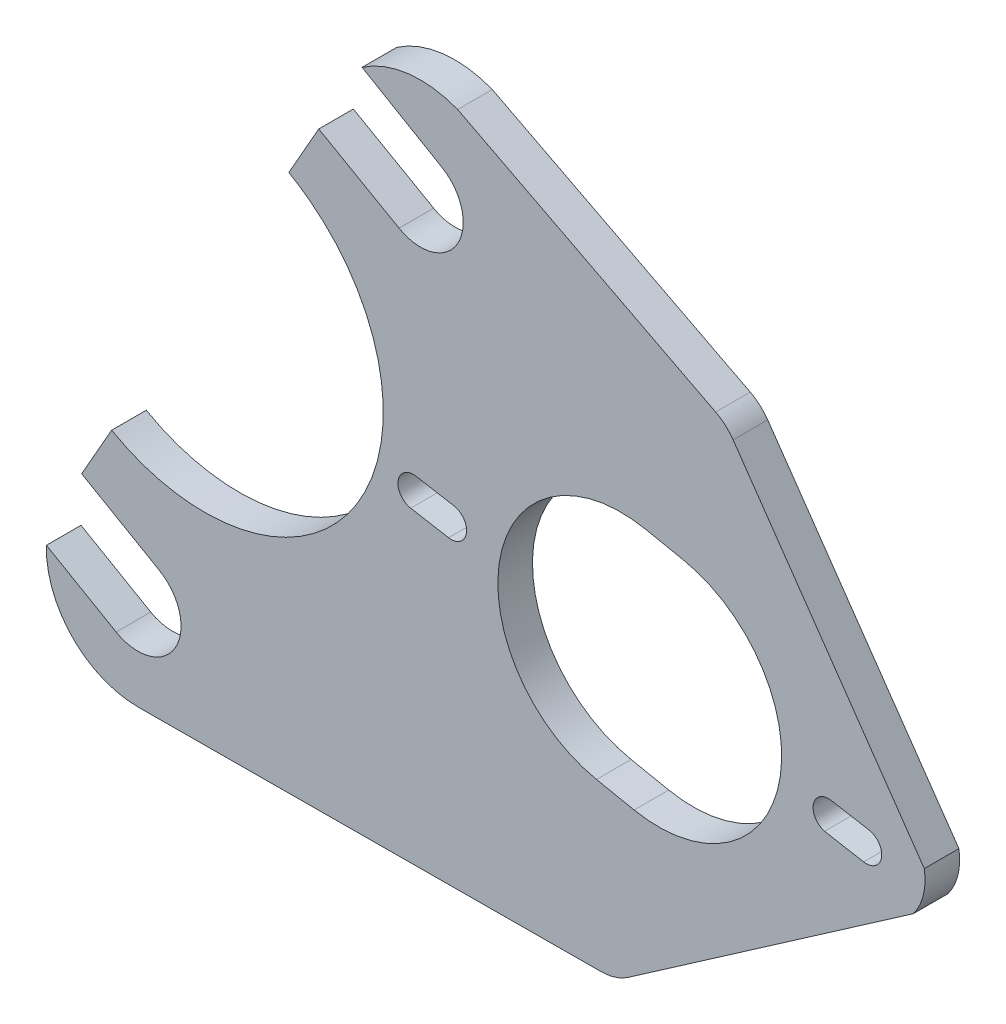
from build123d import *

# Parameters (mm, degrees)
BOSS_EXTRUDE1_DEPTH = 3.6
CUT_EXTRUDE1_DEPTH  = 10
BOSS_EXTRUDE2_DEPTH = 3.6
FILLET2_R           = 5
FILLET3_R           = 5
CUT_EXTRUDE4_DEPTH  = 10


with BuildPart() as part:
    # Model → Boss-Extrude1 (new body)
    with BuildSketch(Plane.XY):
        with BuildLine():
            ThreePointArc((50.228535872, 45.395569416), (52.924019536, 38.465315249), (59.782889449, 35.593041144))
            Line((59.782889449, 35.593041144), (113.827054853, 35.866410266))
            Line((113.827054853, 35.866410266), (139.096203594, 35.866410266))
            Line((139.096203594, 35.866410266), (143.174409672, 59.637869067))
            Line((143.174409672, 59.637869067), (92.999499813, 106.036140475))
            ThreePointArc((92.999499813, 106.036140475), (87.882885081, 106.693381362), (83.060832366, 104.860482154))
            Line((83.060832366, 104.860482154), (91.356130692, 100.009349623))
            ThreePointArc((91.356130692, 100.009349623), (92.985626216, 93.927680535), (86.903957127, 92.29818501))
            Line((86.903957127, 92.29818501), (78.555180285, 97.056247849))
            Line((78.555180285, 97.056247849), (75.4400478, 91.575203017))
            add(Edge.make_bspline(
                [(57.012133278, 59.151469471), (73.67768742, 49.679660596), (82.891644681, 65.891527369), (92.105601941, 82.103394142), (75.4400478, 91.575203017)],
                knots=[4.71238898, 4.71238898, 4.71238898, 6.283185307, 6.283185307, 7.853981634, 7.853981634, 7.853981634], degree=2, weights=[1, 0.707106781, 1, 0.707106781, 1]))
            Line((57.012133278, 59.151469471), (53.897000793, 53.67042464))
            Line((53.897000793, 53.67042464), (61.984810396, 49.000227317))
            ThreePointArc((61.984810396, 49.000227318), (63.628806933, 42.852421177), (57.481000793, 41.20842464))
            Line((57.481000793, 41.20842464), (50.228535872, 45.395569416))
        make_face()
        with BuildLine():
            ThreePointArc((131.161569827, 60.100370477), (130.006797557, 61.990672634), (131.847360572, 63.22317782))
            Line((131.847360572, 63.22317782), (135.786606546, 62.52866997))
            ThreePointArc((135.786606546, 62.52866997), (137.0843143, 60.674111066), (135.228884267, 59.377649136))
            Line((135.228884267, 59.377649136), (131.161569827, 60.100370477))
        make_face(mode=Mode.SUBTRACT)
        with BuildLine():
            Line((88.671682294, 70.836214946), (92.610913304, 70.141622223))
            ThreePointArc((92.610913304, 70.141622223), (93.908768619, 68.288092733), (92.05523913, 66.990237415))
            Line((92.05523913, 66.990237415), (88.116008116, 67.684830138))
            ThreePointArc((88.116008116, 67.684830138), (86.818152801, 69.538359631), (88.671682294, 70.836214946))
        make_face(mode=Mode.SUBTRACT)
        with BuildLine():
            Line((112.523140626, 77.999162994), (116.44350371, 77.204963218))
            ThreePointArc((116.44350371, 77.204963218), (126.447226298, 62.118362064), (111.360625143, 52.114639476))
            Line((111.360625143, 52.114639476), (107.440262059, 52.908839252))
            ThreePointArc((107.440262059, 52.908839252), (97.436539471, 67.995440406), (112.523140626, 77.999162994))
        make_face(mode=Mode.SUBTRACT)
    extrude(amount=BOSS_EXTRUDE1_DEPTH)

    # Sketch1 → Cut-Extrude1 (cut)
    with BuildSketch(Plane(origin=(0, 0, 0), x_dir=(-1, 0, 0), z_dir=(0, 0, -1))):
        Polygon((-111.037829948, 36.937189918), (-140.869018833, 57.620278897), (-151.014903895, 64.654803881), (-139.168658951, 25.748061744), (-100.690846138, 27.008956511), (-96.89763307, 27.13325782), align=None)
    extrude(amount=-CUT_EXTRUDE1_DEPTH, mode=Mode.SUBTRACT)

    # Sketch2 → Boss-Extrude2 (add)
    with BuildSketch(Plane.XY.offset(3.6)):
        Polygon((92.999499813, 106.036140475), (143.024707588, 59.776303156), (141.625060148, 61.795012605), (120.941971169, 91.62620149), align=None)
    extrude(amount=-BOSS_EXTRUDE2_DEPTH)

    # Fillet2
    fillet2_edges = [part.edges().sort_by_distance(p)[0] for p in [
        (109.461597782, 35.844328675, 1.8),
    ]]
    fillet(fillet2_edges, radius=FILLET2_R)

    # Fillet3
    fillet3_edges = [part.edges().sort_by_distance(p)[0] for p in [
        (120.941971169, 91.62620149, 1.8),
    ]]
    fillet(fillet3_edges, radius=FILLET3_R)

    # Sketch4 → Cut-Extrude4 (cut)
    with BuildSketch(Plane(origin=(0, 0, 0), x_dir=(-1, 0, 0), z_dir=(0, 0, -1))):
        with BuildLine():
            Line((-139.736629218, 65.356597838), (-145.722109327, 59.610067808))
            Line((-145.722109327, 59.610067808), (-139.736629218, 56.549346698))
            ThreePointArc((-139.736629218, 56.549346698), (-141.61342704, 60.952972268), (-139.736629218, 65.356597838))
        make_face()
    extrude(amount=-CUT_EXTRUDE4_DEPTH, mode=Mode.SUBTRACT)


solid = part.part
